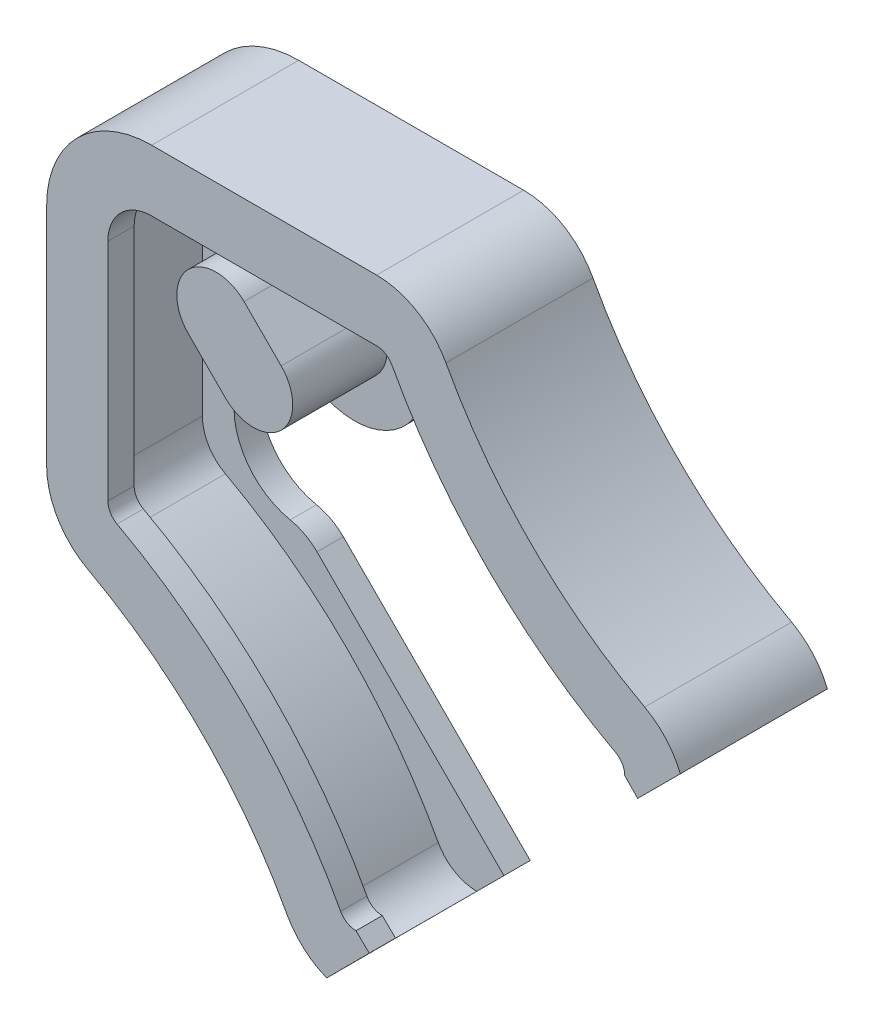
from build123d import *

# Parameters (mm, degrees)
CROQUIS4_R              = 4
SALIENTE_EXTRUIR1_DEPTH = 1.5
SALIENTE_EXTRUIR2_DEPTH = 6.9
SALIENTE_EXTRUIR3_DEPTH = 1.5
CORTAR_EXTRUIR1_DEPTH   = 1.5
REDONDEO1_R             = 3


with BuildPart() as part:
    # Croquis4 → Saliente-Extruir1 (new body)
    with BuildSketch(Plane.XY):
        with BuildLine():
            Line((-683.531695239, 333.374182683), (-683.531695239, 346.225865369))
            ThreePointArc((-683.531695239, 346.225865369), (-682.360122363, 349.054292493), (-679.531695239, 350.225865369))
            Line((-679.531695239, 350.225865369), (-666.680012553, 350.225865369))
            ThreePointArc((-666.680012553, 350.225865369), (-665.398822158, 349.872619004), (-664.479692443, 348.912706306))
            ThreePointArc((-664.479692443, 348.912706306), (-659.289054552, 341.941594121), (-652.317942367, 336.75095623))
            ThreePointArc((-652.317942367, 336.75095623), (-651.358029669, 335.831826514), (-651.004783304, 334.550636119))
            Line((-651.004783304, 334.550636119), (-667.856465989, 317.698953434))
            ThreePointArc((-667.856465989, 317.698953434), (-669.137656384, 318.052199798), (-670.0567861, 319.012112496))
            ThreePointArc((-670.0567861, 319.012112496), (-675.247423991, 325.983224681), (-682.218536176, 331.173862573))
            ThreePointArc((-682.218536176, 331.173862573), (-683.178448874, 332.092992288), (-683.531695239, 333.374182683))
        make_face()
        with Locations((-667.975346053, 334.669516182)):
            Circle(CROQUIS4_R, mode=Mode.SUBTRACT)
        with BuildLine():
            Line((-675.753520646, 345.629671291), (-673.632200302, 343.508350947))
            ThreePointArc((-673.632200302, 343.508350947), (-673.632200302, 340.326370432), (-676.814180817, 340.326370432))
            Line((-676.814180817, 340.326370432), (-678.935501161, 342.447690776))
            ThreePointArc((-678.935501161, 342.447690776), (-678.935501161, 345.629671291), (-675.753520646, 345.629671291))
        make_face(mode=Mode.SUBTRACT)
        with BuildLine():
            Line((-669.475346053, 344.419516182), (-669.475346053, 342.419516182))
            ThreePointArc((-669.475346053, 342.419516182), (-667.975346053, 340.919516182), (-666.475346053, 342.419516182))
            Line((-666.475346053, 342.419516182), (-666.475346053, 344.419516182))
            ThreePointArc((-666.475346053, 344.419516182), (-667.975346053, 345.919516182), (-669.475346053, 344.419516182))
        make_face(mode=Mode.SUBTRACT)
        with BuildLine():
            Line((-658.225346053, 336.169516182), (-660.225346053, 336.169516182))
            ThreePointArc((-660.225346053, 336.169516182), (-661.725346053, 334.669516182), (-660.225346053, 333.169516182))
            Line((-660.225346053, 333.169516182), (-658.225346053, 333.169516182))
            ThreePointArc((-658.225346053, 333.169516182), (-656.725346053, 334.669516182), (-658.225346053, 336.169516182))
        make_face(mode=Mode.SUBTRACT)
        with BuildLine():
            Line((-666.475346053, 324.919516182), (-666.475346053, 326.919516182))
            ThreePointArc((-666.475346053, 326.919516182), (-667.975346053, 328.419516182), (-669.475346053, 326.919516182))
            Line((-669.475346053, 326.919516182), (-669.475346053, 324.919516182))
            ThreePointArc((-669.475346053, 324.919516182), (-667.975346053, 323.419516182), (-666.475346053, 324.919516182))
        make_face(mode=Mode.SUBTRACT)
        with BuildLine():
            Line((-677.725346053, 333.169516182), (-675.725346053, 333.169516182))
            ThreePointArc((-675.725346053, 333.169516182), (-674.225346053, 334.669516182), (-675.725346053, 336.169516182))
            Line((-675.725346053, 336.169516182), (-677.725346053, 336.169516182))
            ThreePointArc((-677.725346053, 336.169516182), (-679.225346053, 334.669516182), (-677.725346053, 333.169516182))
        make_face(mode=Mode.SUBTRACT)
    extrude(amount=SALIENTE_EXTRUIR1_DEPTH)

    # Croquis5 → Saliente-Extruir2 (add)
    with BuildSketch(Plane(origin=(0, 0, 0), x_dir=(-1, 0, 0), z_dir=(0, 0, -1))):
        with BuildLine():
            ThreePointArc((670.0567861, 319.012112496), (669.137656384, 318.052199798), (667.856465989, 317.698953434))
            Line((667.856465989, 317.698953434), (669.532640967, 316.022778456))
            ThreePointArc((669.532640967, 316.022778456), (670.853714641, 316.842392616), (671.817042188, 318.062639746))
            ThreePointArc((671.817042188, 318.062639746), (676.661637554, 324.569011119), (683.168008926, 329.413606484))
            ThreePointArc((683.168008926, 329.413606484), (684.895851783, 331.068039972), (685.531695239, 333.374182683))
            Line((685.531695239, 333.374182683), (685.531695239, 346.225865369))
            ThreePointArc((685.531695239, 346.225865369), (683.774335926, 350.468506056), (679.531695239, 352.225865369))
            Line((679.531695239, 352.225865369), (666.680012553, 352.225865369))
            ThreePointArc((666.680012553, 352.225865369), (664.373869842, 351.590021913), (662.719436354, 349.862179056))
            ThreePointArc((662.719436354, 349.862179056), (657.874840989, 343.355807684), (651.368469617, 338.511212318))
            ThreePointArc((651.368469617, 338.511212318), (650.148222486, 337.547884771), (649.328608326, 336.226811097))
            Line((649.328608326, 336.226811097), (651.004783304, 334.550636119))
            ThreePointArc((651.004783304, 334.550636119), (651.358029669, 335.831826514), (652.317942367, 336.75095623))
            ThreePointArc((652.317942367, 336.75095623), (659.289054552, 341.941594121), (664.479692443, 348.912706306))
            ThreePointArc((664.479692443, 348.912706306), (665.398822158, 349.872619004), (666.680012553, 350.225865369))
            Line((666.680012553, 350.225865369), (679.531695239, 350.225865369))
            ThreePointArc((679.531695239, 350.225865369), (682.360122363, 349.054292493), (683.531695239, 346.225865369))
            Line((683.531695239, 346.225865369), (683.531695239, 333.374182683))
            ThreePointArc((683.531695239, 333.374182683), (683.178448874, 332.092992288), (682.218536176, 331.173862573))
            ThreePointArc((682.218536176, 331.173862573), (675.247423991, 325.983224681), (670.0567861, 319.012112496))
        make_face()
        with BuildLine():
            ThreePointArc((678.935501161, 342.447690776), (678.935501161, 345.629671291), (675.753520646, 345.629671291))
            Line((675.753520646, 345.629671291), (673.632200302, 343.508350947))
            ThreePointArc((673.632200302, 343.508350947), (673.632200302, 340.326370432), (676.814180817, 340.326370432))
            Line((676.814180817, 340.326370432), (678.935501161, 342.447690776))
        make_face()
    extrude(amount=-SALIENTE_EXTRUIR2_DEPTH)

    # Croquis6 → Saliente-Extruir3 (add)
    with BuildSketch(Plane.XY.offset(6.9)):
        with BuildLine():
            Line((-667.856465989, 319.198953434), (-667.100243806, 318.465261145))
            Line((-667.100243806, 318.465261145), (-669.532640967, 316.022778456))
            ThreePointArc((-669.532640967, 316.022778456), (-670.853714641, 316.842392616), (-671.817042188, 318.062639746))
            ThreePointArc((-671.817042188, 318.062639746), (-676.661637554, 324.569011119), (-683.168008926, 329.413606484))
            ThreePointArc((-683.168008926, 329.413606484), (-684.895851783, 331.068039972), (-685.531695239, 333.374182683))
            Line((-685.531695239, 333.374182683), (-685.531695239, 346.225865369))
            ThreePointArc((-685.531695239, 346.225865369), (-683.774335926, 350.468506056), (-679.531695239, 352.225865369))
            Line((-679.531695239, 352.225865369), (-666.680012553, 352.225865369))
            ThreePointArc((-666.680012553, 352.225865369), (-664.373869842, 351.590021913), (-662.719436354, 349.862179056))
            ThreePointArc((-662.719436354, 349.862179056), (-657.874840989, 343.355807684), (-651.368469617, 338.511212318))
            ThreePointArc((-651.368469617, 338.511212318), (-650.148222486, 337.547884771), (-649.328608326, 336.226811097))
            Line((-649.328608326, 336.226811097), (-651.765332209, 333.790087215))
            Line((-651.765332209, 333.790087215), (-652.503991007, 334.551428417))
            ThreePointArc((-652.503991007, 334.551428417), (-652.645289552, 335.063904575), (-653.029254632, 335.431556461))
            ThreePointArc((-653.029254632, 335.431556461), (-660.349095394, 340.881501273), (-665.799494351, 348.201003883))
            ThreePointArc((-665.799494351, 348.201003883), (-666.167146237, 348.584968962), (-666.679622395, 348.726267508))
            Line((-666.679622395, 348.726267508), (-679.53130508, 348.726267508))
            ThreePointArc((-679.53130508, 348.726267508), (-681.299072033, 347.994034461), (-682.03130508, 346.226267508))
            Line((-682.03130508, 346.226267508), (-682.03130508, 333.374584822))
            ThreePointArc((-682.03130508, 333.374584822), (-681.890006535, 332.862108664), (-681.506041455, 332.494456778))
            ThreePointArc((-681.506041455, 332.494456778), (-674.186373661, 327.044286992), (-668.736203875, 319.724619198))
            ThreePointArc((-668.736203875, 319.724619198), (-668.368791902, 319.340524583), (-667.856465989, 319.198953434))
        make_face()
    extrude(amount=SALIENTE_EXTRUIR3_DEPTH)

    # Croquis7 → Cortar-Extruir1 (cut)
    with BuildSketch(Plane.XY.offset(1.5)):
        with BuildLine():
            Line((-677.725346053, 330.669516182), (-666.305624647, 319.249794777))
            Line((-666.305624647, 319.249794777), (-652.555624647, 332.999794777))
            Line((-652.555624647, 332.999794777), (-663.975346053, 344.419516182))
            ThreePointArc((-663.975346053, 344.419516182), (-667.975346053, 348.419516182), (-671.975346053, 344.419516182))
            ThreePointArc((-671.975346053, 344.419516182), (-671.975346053, 338.669516182), (-677.725346053, 338.669516182))
            ThreePointArc((-677.725346053, 338.669516182), (-681.725346053, 334.669516182), (-677.725346053, 330.669516182))
        make_face()
    extrude(amount=-CORTAR_EXTRUIR1_DEPTH, mode=Mode.SUBTRACT)

    # Redondeo1
    redondeo1_edges = [part.edges().sort_by_distance(p)[0] for p in [
        (-677.725346053, 330.669516182, 0.75),
        (-677.725346053, 338.669516182, 0.75),
        (-671.975346053, 344.419516182, 0.75),
        (-663.975346053, 344.419516182, 0.75),
    ]]
    fillet(redondeo1_edges, radius=REDONDEO1_R)


solid = part.part
